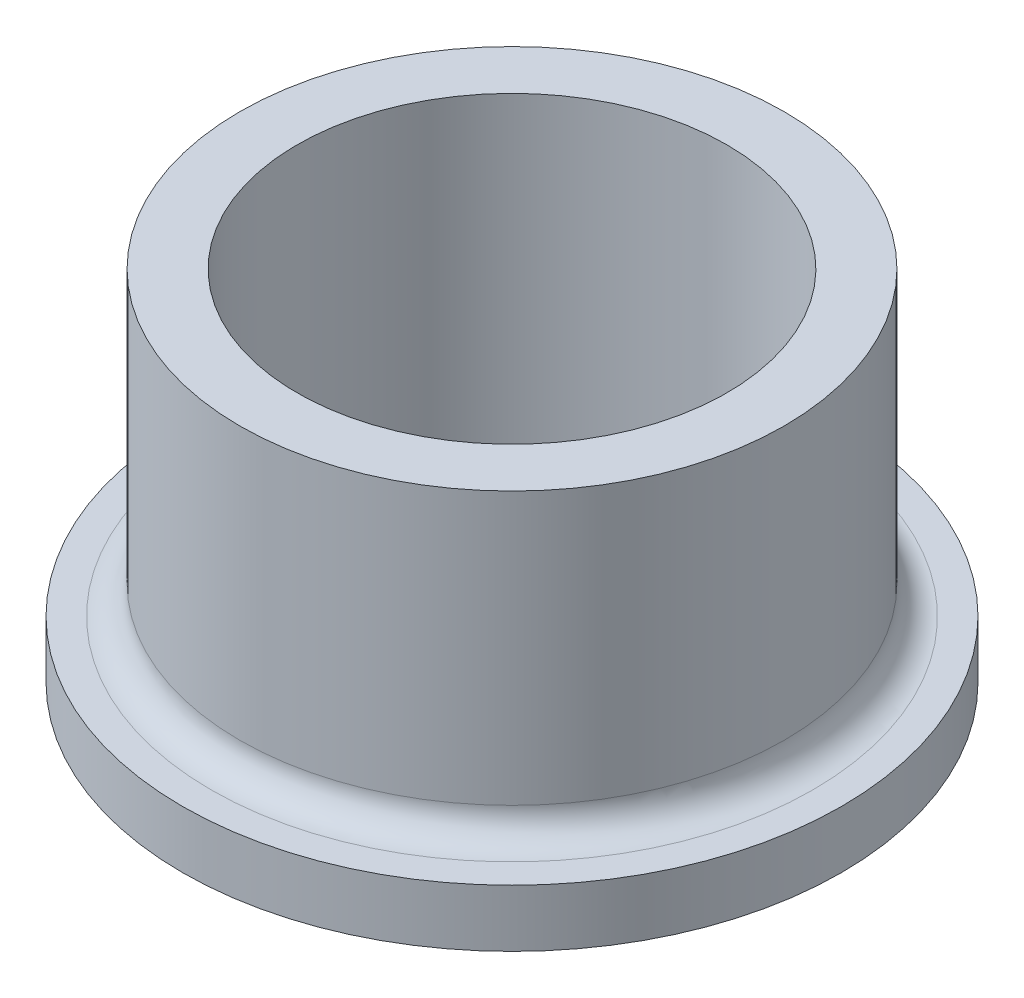
from build123d import *


with BuildPart() as part:
    # Sketch1 → Revolve1 (revolve)
    with BuildSketch(Plane.XY, mode=Mode.PRIVATE) as revolve1_sk:
        with BuildLine():
            Line((15, 25), (15, 2))
            ThreePointArc((15, 2), (15.585786438, 0.585786438), (17, 0))
            Line((17, 0), (23, 0))
            Line((23, 0), (23, 4))
            Line((23, 4), (21, 4))
            ThreePointArc((21, 4), (19.585786438, 4.585786438), (19, 6))
            Line((19, 6), (19, 25))
            Line((19, 25), (15, 25))
        make_face()
    revolve(revolve1_sk.sketch.rotate(Axis((0, 0, 0), (0, 1, 0)), 90), axis=Axis((0, 0, 0), (0, 1, 0)))


solid = part.part
